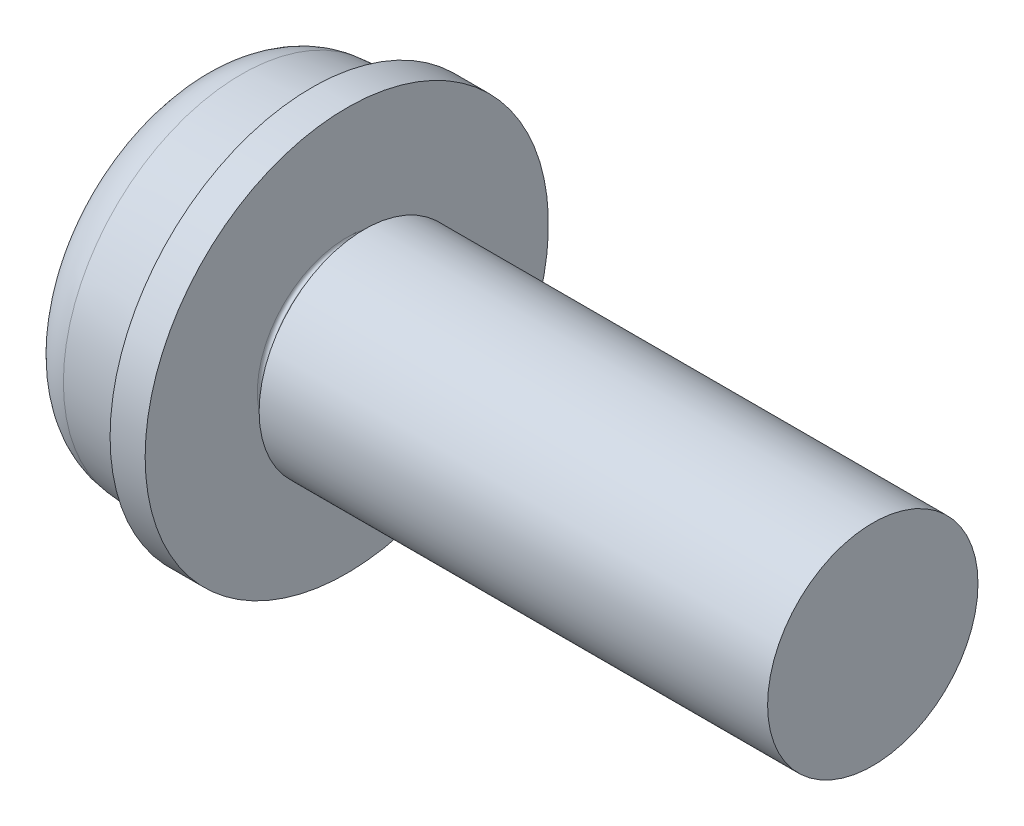
from build123d import *

# Parameters (mm, degrees)
CUT_EXTRUDE_1_DEPTH = 2
CUT_EXTRUDE_1_TAPER = 8
FILLET_1_R          = 0.1


with BuildPart() as part:
    # ｽｹｯﾁ1 → Revolve 833 (revolve)
    with BuildSketch(Plane.XY):
        with BuildLine():
            Line((-3.007077042, 5.074403512), (-1, 5.25))
            Line((-1, 5.25), (-1, 5.75))
            Line((-1, 5.75), (0, 5.75))
            Line((0, 5.75), (0, 2.45))
            Line((0, 2.45), (0.5, 2.45))
            Line((0.5, 2.45), (0.5, 3))
            Line((0.5, 3), (15, 3))
            Line((15, 3), (15, 0))
            Line((15, 0), (-4.9, 0))
            ThreePointArc((-4.9, 0), (-4.752600206, 2.026195333), (-4.313504639, 4.009724841))
            ThreePointArc((-4.313504639, 4.009724841), (-3.823950263, 4.742884566), (-3.007077042, 5.074403512))
        make_face()
    revolve(axis=Axis((0, 0, 0), (1, 0, 0)))

    # ｽｹｯﾁ2 → ｶｯﾄ - 押し出し1 (cut)
    with BuildSketch(Plane(origin=(-4.9, 0, 0), x_dir=(0, 0, -1), z_dir=(1, 0, 0))):
        with BuildLine():
            Line((0.71, -3.15), (0.71, -1.01))
            ThreePointArc((0.71, -1.01), (0.797867966, -0.797867966), (1.01, -0.71))
            Line((1.01, -0.71), (3.15, -0.71))
            Line((3.15, -0.71), (3.15, 0.71))
            Line((3.15, 0.71), (1.01, 0.71))
            ThreePointArc((1.01, 0.71), (0.797867966, 0.797867966), (0.71, 1.01))
            Line((0.71, 1.01), (0.71, 3.15))
            Line((0.71, 3.15), (-0.71, 3.15))
            Line((-0.71, 3.15), (-0.71, 1.01))
            ThreePointArc((-0.71, 1.01), (-0.797867966, 0.797867966), (-1.01, 0.71))
            Line((-1.01, 0.71), (-3.15, 0.71))
            Line((-3.15, 0.71), (-3.15, -0.71))
            Line((-3.15, -0.71), (-1.01, -0.71))
            ThreePointArc((-1.01, -0.71), (-0.797867966, -0.797867966), (-0.71, -1.01))
            Line((-0.71, -1.01), (-0.71, -3.15))
            Line((-0.71, -3.15), (0.71, -3.15))
        make_face()
    extrude(amount=CUT_EXTRUDE_1_DEPTH, taper=CUT_EXTRUDE_1_TAPER, mode=Mode.SUBTRACT)

    # ﾌｨﾚｯﾄ1
    fillet_1_edges = [part.edges().sort_by_distance(p)[0] for p in [
        (0, -2.45, 0),
    ]]
    fillet(fillet_1_edges, radius=FILLET_1_R)


solid = part.part
